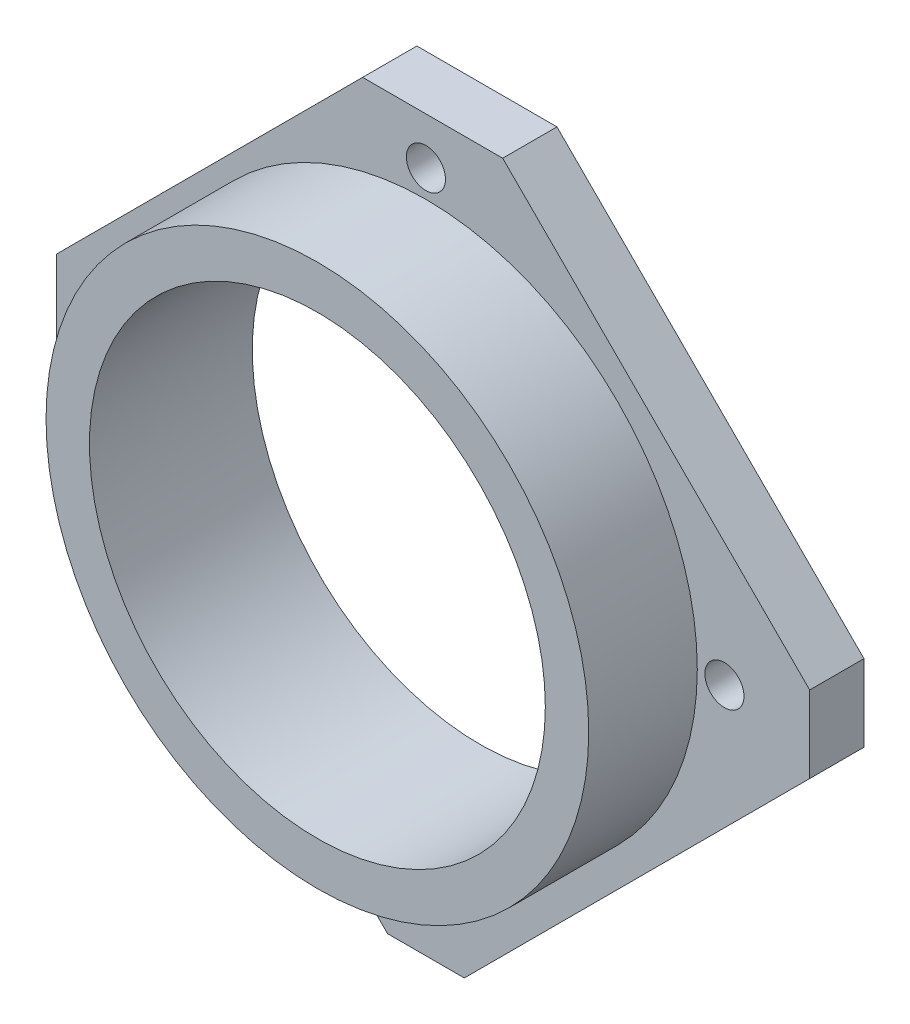
from build123d import *

# Parameters (mm, degrees)
SKETCH1_R           = 1.8
SKETCH1_R_2         = 21
BOSS_EXTRUDE1_DEPTH = 5
SKETCH2_R           = 25
SKETCH2_R_2         = 21
BOSS_EXTRUDE2_DEPTH = 10


with BuildPart() as part:
    # Sketch1 → Boss-Extrude1 (new body)
    with BuildSketch(Plane.XY):
        Polygon((-3.535533906, -35.355339059), (-34.029102601, -4.861770365), (-34.029102601, 3.62351101), (-5.832808457, 31.819805153), (7.071067812, 31.819805153), (35.355339059, 3.535533906), (35.355339059, -3.535533906), (3.535533906, -35.355339059), align=None)
        with Locations((27.5, 0)):
            Circle(SKETCH1_R, mode=Mode.SUBTRACT)
        with Locations((0, -27.5)):
            Circle(SKETCH1_R, mode=Mode.SUBTRACT)
        with Locations((0, 27.5)):
            Circle(SKETCH1_R, mode=Mode.SUBTRACT)
        Circle(SKETCH1_R_2, mode=Mode.SUBTRACT)
        with Locations((-27.5, 0)):
            Circle(SKETCH1_R, mode=Mode.SUBTRACT)
    extrude(amount=BOSS_EXTRUDE1_DEPTH)

    # Sketch2 → Boss-Extrude2 (add)
    with BuildSketch(Plane.XY.offset(5)):
        Circle(SKETCH2_R)
        Circle(SKETCH2_R_2, mode=Mode.SUBTRACT)
    extrude(amount=BOSS_EXTRUDE2_DEPTH)


solid = part.part
